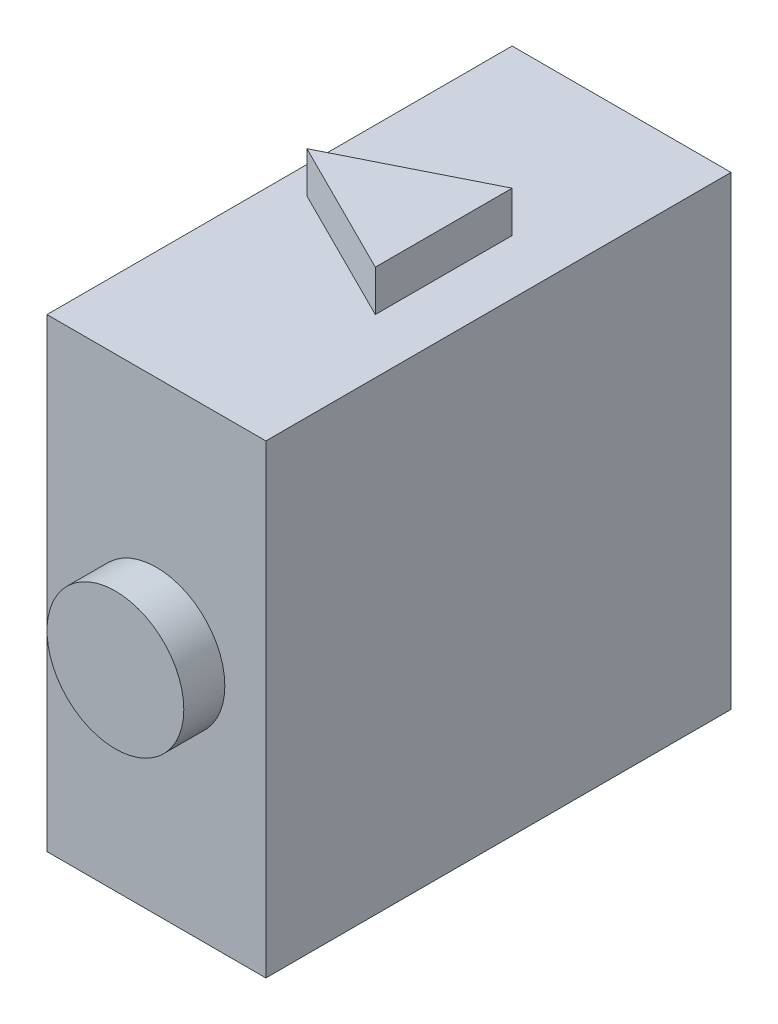
from build123d import *

# Parameters (mm, degrees)
SKETCH1_W           = 16
SKETCH1_H           = 34
BOSS_EXTRUDE1_DEPTH = 17
SKETCH2_W           = 24
SKETCH2_H           = 26
CUT_EXTRUDE1_DEPTH  = 3
SKETCH3_R           = 5
BOSS_EXTRUDE2_DEPTH = 1.5
BOSS_EXTRUDE3_DEPTH = 1.5


with BuildPart() as part:
    # Sketch1 → Boss-Extrude1 (new, symmetric)
    with BuildSketch(Plane(origin=(0, 23, 0), x_dir=(1, 0, 0), z_dir=(0, 1, 0))):
        Rectangle(SKETCH1_W, SKETCH1_H)
    extrude(amount=BOSS_EXTRUDE1_DEPTH, both=True)

    # Sketch2 → Cut-Extrude1 (cut, symmetric)
    with BuildSketch(Plane(origin=(-5, 0, 0), x_dir=(0, 0, -1), z_dir=(1, 0, 0))):
        with Locations((0, 23)):
            Rectangle(SKETCH2_W, SKETCH2_H)
    extrude(amount=CUT_EXTRUDE1_DEPTH, both=True, mode=Mode.SUBTRACT)

    # Sketch3 → Boss-Extrude2 (add, symmetric)
    with BuildSketch(Plane.XY.offset(18.5)):
        with Locations((0, 23)):
            Circle(SKETCH3_R)
    extrude(amount=BOSS_EXTRUDE2_DEPTH, both=True)

    # Sketch4 → Boss-Extrude3 (add, symmetric)
    with BuildSketch(Plane(origin=(0, 41.5, 0), x_dir=(1, 0, 0), z_dir=(0, 1, 0))):
        Polygon((4, 5), (4, -5), (-6, 0), align=None)
    extrude(amount=BOSS_EXTRUDE3_DEPTH, both=True)


solid = part.part
